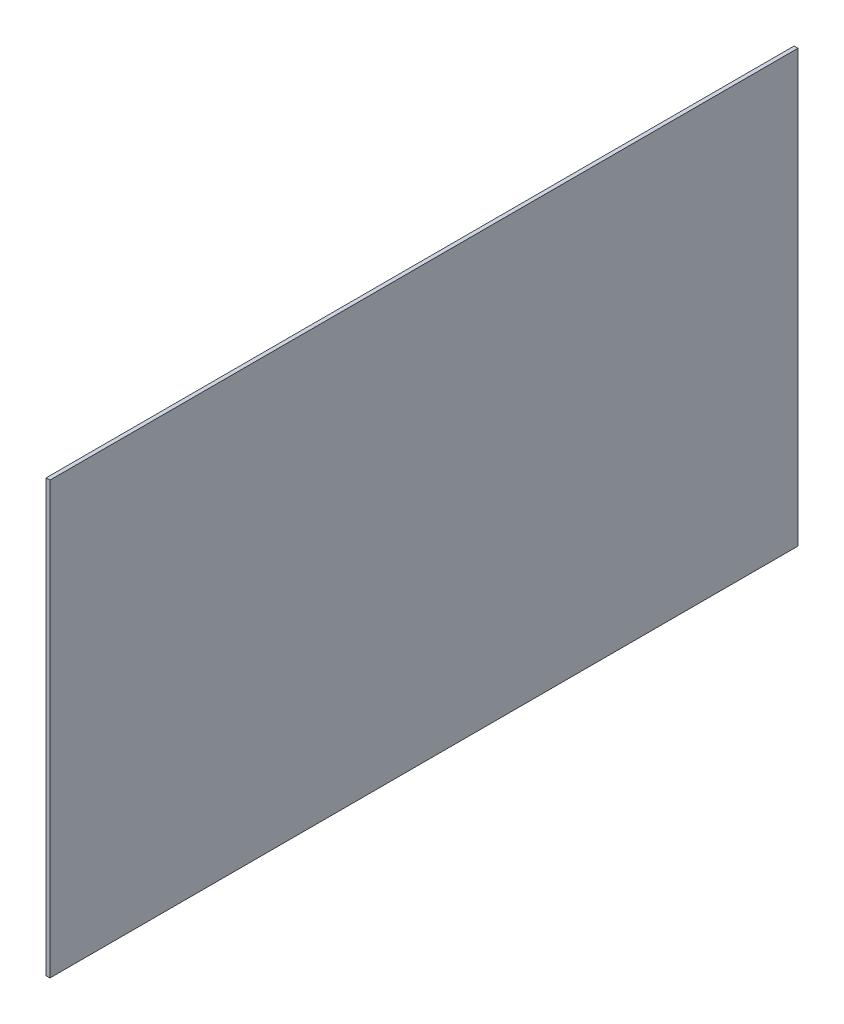
from build123d import *

# Parameters (mm, degrees)
SKETCH1_W           = 1828.8
SKETCH1_H           = 1054.1
BOSS_EXTRUDE1_DEPTH = 9.525


with BuildPart() as part:
    # Sketch1 → Boss-Extrude1 (new body)
    with BuildSketch(Plane(origin=(0, 0, 0), x_dir=(0, 0, -1), z_dir=(1, 0, 0))):
        with Locations((914.4, 527.05)):
            Rectangle(SKETCH1_W, SKETCH1_H)
    extrude(amount=BOSS_EXTRUDE1_DEPTH)


solid = part.part
